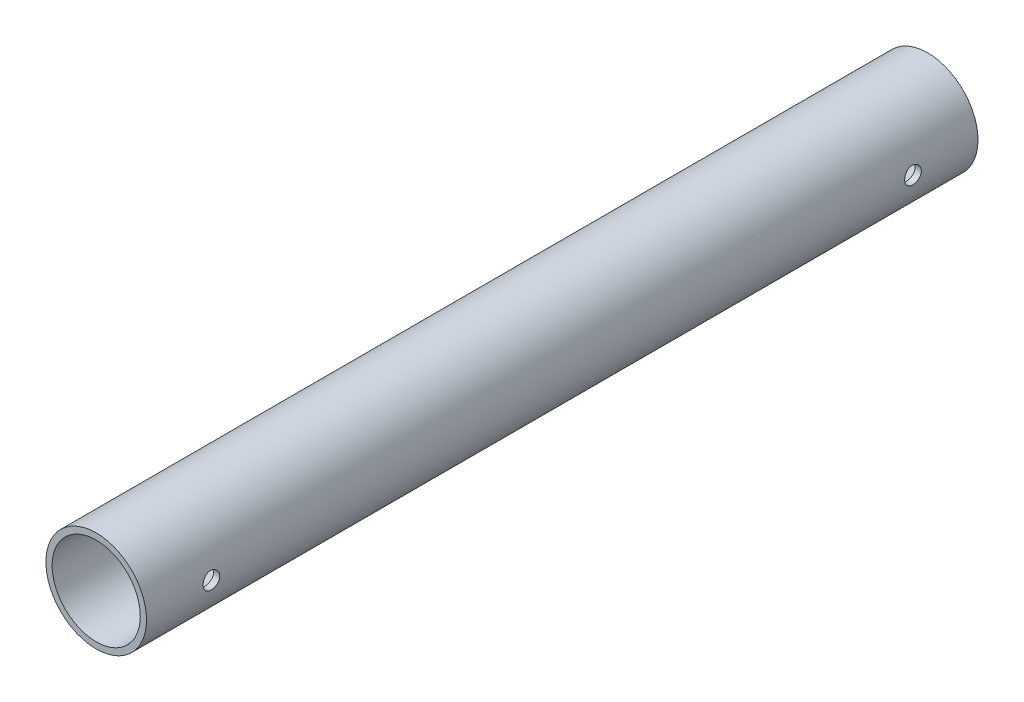
from build123d import *

# Parameters (mm, degrees)
SKETCH1_R           = 12.1
SKETCH1_R_2         = 10.6
BOSS_EXTRUDE1_DEPTH = 100
SKETCH8_R           = 2
CUT_EXTRUDE2_DEPTH  = 104.616567834


with BuildPart() as part:
    # Sketch1 → Boss-Extrude1 (new body)
    with BuildSketch(Plane.XY):
        with Locations((0.713024601, 11.821110558)):
            Circle(SKETCH1_R)
        with Locations((0.713024601, 11.821110558)):
            Circle(SKETCH1_R_2, mode=Mode.SUBTRACT)
    boss_extrude1 = extrude(amount=BOSS_EXTRUDE1_DEPTH)

    # Sketch8 → Cut-Extrude2 (cut, symmetric)
    with BuildSketch(Plane(origin=(0, 0, 0), x_dir=(0, 0, -1), z_dir=(1, 0, 0))):
        with Locations((-84.375, 12.221110558)):
            Circle(SKETCH8_R)
        with Locations((-151.625, 12.221110558)):
            Circle(SKETCH8_R)
    cut_extrude2 = extrude(amount=CUT_EXTRUDE2_DEPTH, both=True, mode=Mode.SUBTRACT)

    # Mirror1: Boss-Extrude1, Cut-Extrude2 across plane
    add(boss_extrude1.mirror(Plane(origin=(0.713024601, 11.821110558, 0), x_dir=(1, 0, 0), z_dir=(0, 0, 1))))
    add(cut_extrude2.mirror(Plane(origin=(0.713024601, 11.821110558, 0), x_dir=(1, 0, 0), z_dir=(0, 0, 1))), mode=Mode.SUBTRACT)


solid = part.part
